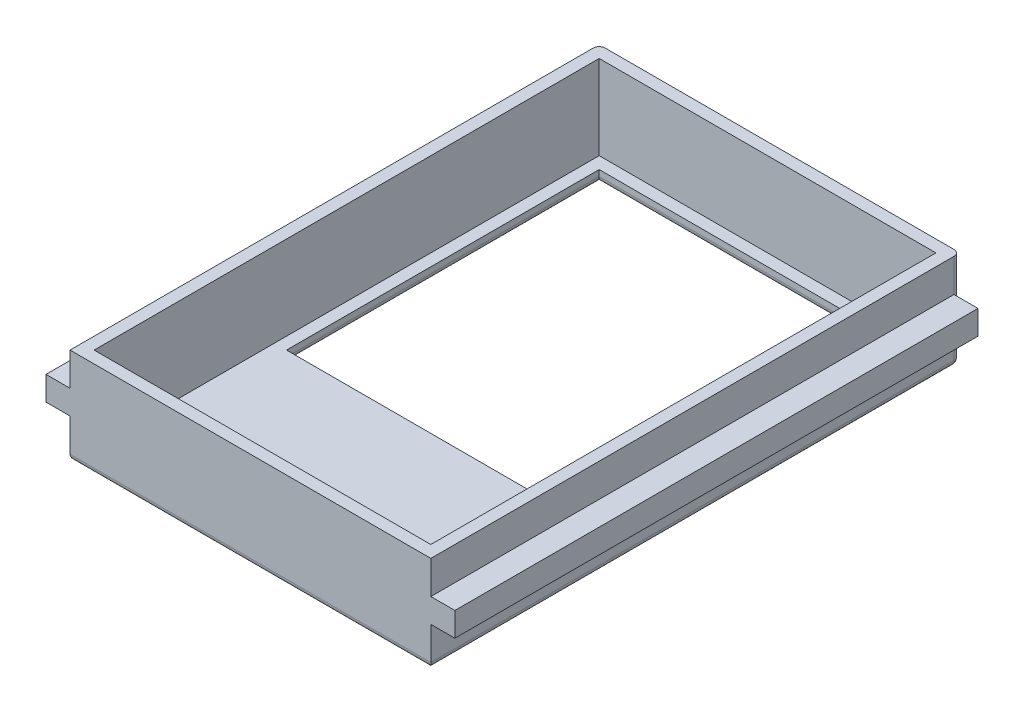
from build123d import *

# Parameters (mm, degrees)
SKETCH1_W           = 30
SKETCH1_H           = 44
BOSS_EXTRUDE3_DEPTH = 1
SKETCH3_W           = 26
SKETCH3_H           = 26
CUT_EXTRUDE1_DEPTH  = 1
SKETCH4_W           = 30
SKETCH4_H           = 44
SKETCH4_W_2         = 28
SKETCH4_H_2         = 42
BOSS_EXTRUDE4_DEPTH = 7
FILLET1_R           = 0.5
SKETCH5_W           = 43.5
SKETCH5_H           = 2
BOSS_EXTRUDE5_DEPTH = 2
SKETCH6_W           = 43.5
SKETCH6_H           = 2
BOSS_EXTRUDE6_DEPTH = 2


with BuildPart() as part:
    # Sketch1 → Boss-Extrude3 (new body)
    with BuildSketch(Plane(origin=(0, 0, 0), x_dir=(1, 0, 0), z_dir=(0, 1, 0))):
        with Locations((15, 22)):
            Rectangle(SKETCH1_W, SKETCH1_H)
    extrude(amount=BOSS_EXTRUDE3_DEPTH)

    # Sketch3 → Cut-Extrude1 (cut)
    with BuildSketch(Plane(origin=(0, 1, 0), x_dir=(1, 0, 0), z_dir=(0, 1, 0))):
        with Locations((15, 29)):
            Rectangle(SKETCH3_W, SKETCH3_H)
    extrude(amount=-CUT_EXTRUDE1_DEPTH, mode=Mode.SUBTRACT)

    # Sketch4 → Boss-Extrude4 (add)
    with BuildSketch(Plane(origin=(0, 1, 0), x_dir=(1, 0, 0), z_dir=(0, 1, 0))):
        with Locations((15, 22)):
            Rectangle(SKETCH4_W, SKETCH4_H)
        with Locations((15, 22)):
            Rectangle(SKETCH4_W_2, SKETCH4_H_2, mode=Mode.SUBTRACT)
    extrude(amount=BOSS_EXTRUDE4_DEPTH)

    # Fillet1
    fillet1_edges = [part.edges().sort_by_distance(p)[0] for p in [
        (2, 0, -29),
        (15, 0, -42),
        (28, 0, -29),
        (15, 0, -16),
        (15, 0, -44),
        (30, 0, -22),
        (15, 0, 0),
        (0, 0, -22),
        (0, 4, -44),
        (30, 4, -44),
    ]]
    fillet(fillet1_edges, radius=FILLET1_R)

    # Sketch5 → Boss-Extrude5 (add)
    with BuildSketch(Plane.ZY):
        with Locations((-21.75, 4.25)):
            Rectangle(SKETCH5_W, SKETCH5_H)
    extrude(amount=BOSS_EXTRUDE5_DEPTH)

    # Sketch6 → Boss-Extrude6 (add)
    with BuildSketch(Plane(origin=(30, 0, 0), x_dir=(0, 0, -1), z_dir=(1, 0, 0))):
        with Locations((21.75, 4.25)):
            Rectangle(SKETCH6_W, SKETCH6_H)
    extrude(amount=BOSS_EXTRUDE6_DEPTH)


solid = part.part
